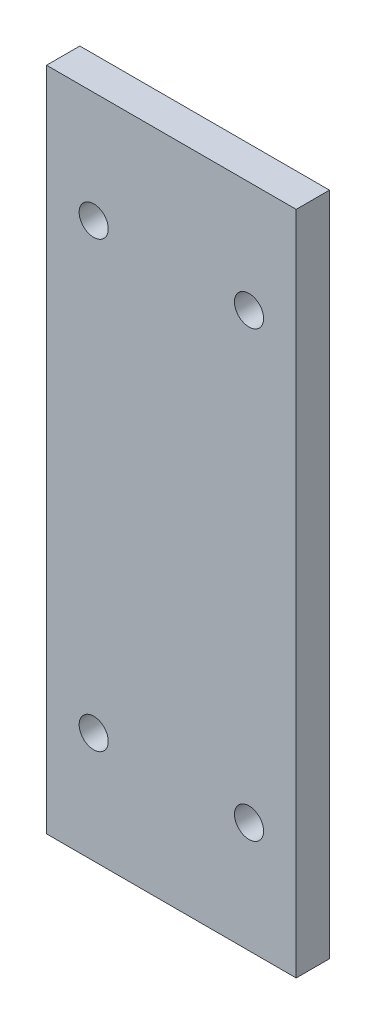
from build123d import *

# Parameters (mm, degrees)
SZKIC1_W                    = 90
SZKIC1_H                    = 240
DODANIE_WYCI_GNI_CIE1_DEPTH = 12
OTW_R_GWINTOWANY_M12X1_51_D = 10.5


with BuildPart() as part:
    # Szkic1 → Dodanie-wyciągnięcie1 (new body)
    with BuildSketch(Plane.XY):
        with Locations((-40, -600)):
            Rectangle(SZKIC1_W, SZKIC1_H)
    extrude(amount=DODANIE_WYCI_GNI_CIE1_DEPTH)

    # Otwór gwintowany M12x1.51 (through all)
    with Locations(Plane.XY.offset(12)):
        with Locations((-68, -520), (-68, -680), (-12, -680), (-12, -520)):
            Hole(OTW_R_GWINTOWANY_M12X1_51_D / 2)


solid = part.part
